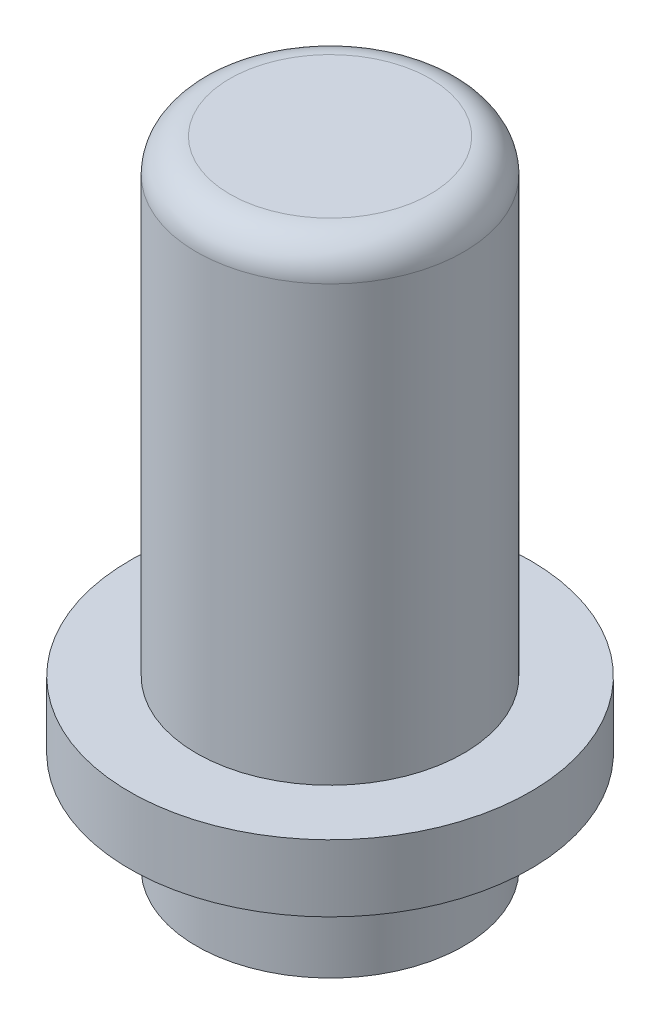
from build123d import *

# Parameters (mm, degrees)
SKETCH_1_R          = 2
EXTRUDE_1_DEPTH     = 7
FILLET_2_R          = 0.5
SKETCH_4_R          = 3
EXTRUDE_2_DEPTH     = 1
EXTRUDE_START       = 1.5
SKETCH_5_R          = 2
EXTRUDE_3_DEPTH     = 1.5
CUT_EXTRUDE_1_DEPTH = 2


with BuildPart() as part:
    # 草图1 → 凸台-拉伸1 (new body)
    with BuildSketch(Plane(origin=(0, 0, 0), x_dir=(1, 0, 0), z_dir=(0, 1, 0))):
        with Locations(Location((0, 0, 0), (0, 0, 270))):
            Circle(SKETCH_1_R)
    extrude(amount=EXTRUDE_1_DEPTH)

    # 圆角2
    fillet_2_edges = [part.edges().sort_by_distance(p)[0] for p in [
        (0, 7, -2),
    ]]
    fillet(fillet_2_edges, radius=FILLET_2_R)

    # 草图4 → 凸台-拉伸2 (add)
    with BuildSketch(Plane.XZ):
        with Locations(Location((0, 0, 0), (0, 0, 270))):
            Circle(SKETCH_4_R)
    extrude(amount=EXTRUDE_2_DEPTH)

    # 草图5 → 凸台-拉伸3 (add)
    with BuildSketch(Plane.XZ.offset(1).offset(EXTRUDE_START)):
        with Locations(Location((0, 0, 0), (0, 0, 90))):
            Circle(SKETCH_5_R)
    extrude(amount=-EXTRUDE_3_DEPTH)

    # 草图6 → 切除-拉伸1 (cut)
    with BuildSketch(Plane.XZ.offset(2.5)):
        Polygon((1.732050808, 0), (0.866025404, 1.5), (-0.866025404, 1.5), (-1.732050808, 0), (-0.866025404, -1.5), (0.866025404, -1.5), align=None)
    extrude(amount=-CUT_EXTRUDE_1_DEPTH, mode=Mode.SUBTRACT)


solid = part.part
